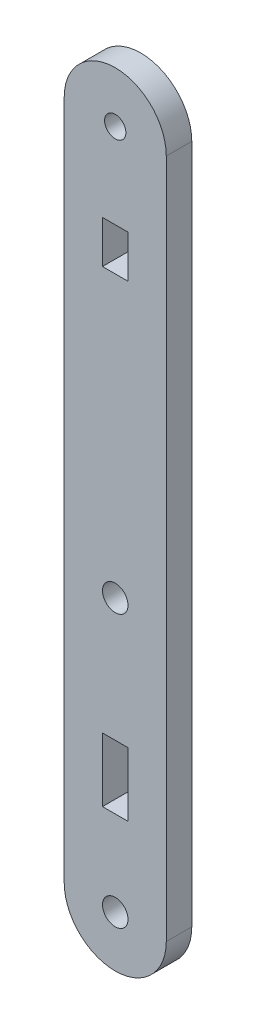
from build123d import *

# Parameters (mm, degrees)
SKETCH_1_R      = 1.25
SKETCH_1_R_2    = 1.5
SKETCH_1_W      = 3
SKETCH_1_H      = 5
SKETCH_1_H_2    = 7.5
EXTRUDE_1_DEPTH = 3


with BuildPart() as part:
    # 草圖1 → 填料-伸長1 (new body)
    with BuildSketch(Plane.XY):
        with BuildLine():
            Line((12.3003, 7.0001), (12.300299998, 87.0001))
            ThreePointArc((12.300299998, 87.0001), (18.300299998, 93.000099998), (24.3003, 87.0001))
            Line((24.3003, 87.0001), (24.3003, 7))
            ThreePointArc((24.3003, 7), (18.300250001, 1.000152423), (12.3003, 7.0001))
        make_face()
        with Locations((18.300299998, 87.000099998)):
            Circle(SKETCH_1_R, mode=Mode.SUBTRACT)
        with Locations((18.3003, 39)):
            Circle(SKETCH_1_R_2, mode=Mode.SUBTRACT)
        with Locations((18.303458052, 7.007081727)):
            Circle(SKETCH_1_R_2, mode=Mode.SUBTRACT)
        with Locations((18.3003, 74.5001)):
            Rectangle(SKETCH_1_W, SKETCH_1_H, mode=Mode.SUBTRACT)
        with Locations((18.3003, 20.7501)):
            Rectangle(SKETCH_1_W, SKETCH_1_H_2, mode=Mode.SUBTRACT)
    extrude(amount=EXTRUDE_1_DEPTH)


solid = part.part
